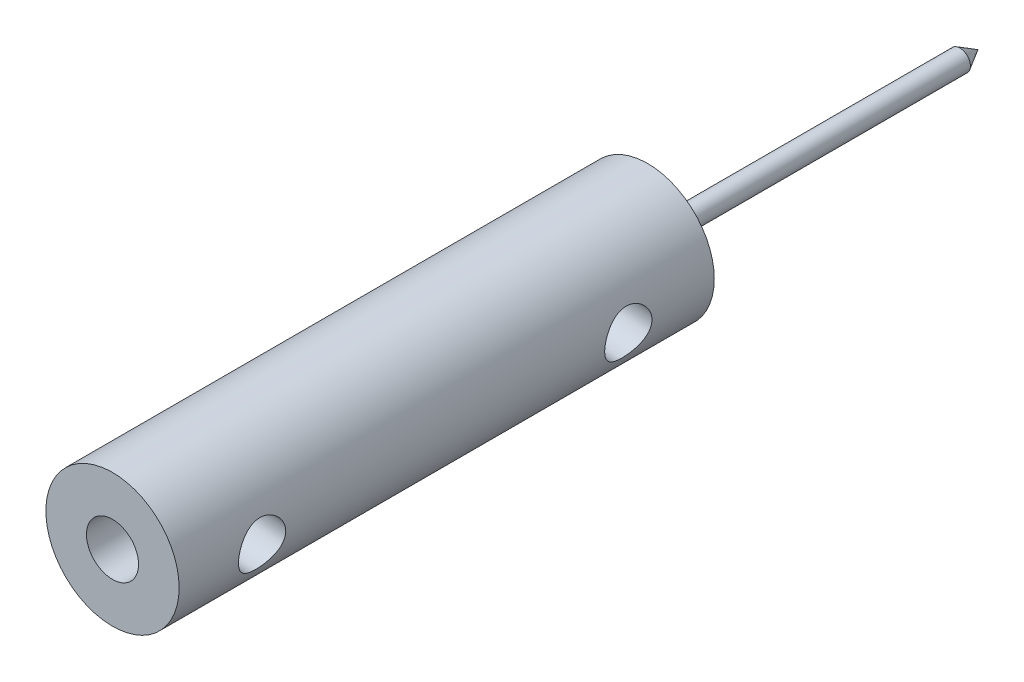
from build123d import *

# Parameters (mm, degrees)
SKETCH3_R                           = 3.2
SKETCH3_R_2                         = 0.5
BOSS_EXTRUDE2_DEPTH                 = 25.7
CUT_EXTRUDE1_DEPTH                  = 27.095401894
CUT_EXTRUDE1_DEPTH_BACK             = 25.7
SKETCH6_R                           = 1.25
TAP_DRILL_FOR_4_40_TAP1_D           = 2.2606
TAP_DRILL_FOR_4_40_TAP1_ON_FACE_2_D = 2.2606
BOSS_EXTRUDE4_START                 = 5
SKETCH3_4_R                         = 0.5
BOSS_EXTRUDE4_DEPTH                 = 20
BOSS_EXTRUDE5_START                 = -20.7
SKETCH6_2_R                         = 1.25
SKETCH6_2_R_2                       = 0.5
BOSS_EXTRUDE5_DEPTH                 = 5


with BuildPart() as part:
    # Sketch3 → Boss-Extrude2 (new body)
    with BuildSketch(Plane.XY):
        with Locations(Location((0, 0, 0), (0, 0, 180))):
            Circle(SKETCH3_R)
        Circle(SKETCH3_R_2, mode=Mode.SUBTRACT)
    extrude(amount=BOSS_EXTRUDE2_DEPTH)

    # Sketch6 → Cut-Extrude1 (cut, two sides: drawn at the far end of the back side and taken through both)
    with BuildSketch(Plane.XY.offset(25.7).offset(-CUT_EXTRUDE1_DEPTH_BACK)):
        with Locations(Location((0, 0, 0), (0, 0, 180))):
            Circle(SKETCH6_R)
    extrude(amount=CUT_EXTRUDE1_DEPTH + CUT_EXTRUDE1_DEPTH_BACK, mode=Mode.SUBTRACT)

    # Tap Drill for #4-40 Tap1 (through all)
    with Locations(Plane(origin=(3.187528357, -0.282246299, 21.7), x_dir=(0.088201968553, 0.996102611553, 0), z_dir=(0.996102611553, -0.088201968553, 0))):
        with Locations((0, 0)):
            Hole(TAP_DRILL_FOR_4_40_TAP1_D / 2)

    # Tap Drill for #4-40 Tap1 on face 2 (through all)
    with Locations(Plane(origin=(3.187528357, -0.282246299, 4.112360987), x_dir=(0.088201965627, 0.996102611812, 0), z_dir=(0.996102611812, -0.088201965627, 0))):
        with Locations((0, 0)):
            Hole(TAP_DRILL_FOR_4_40_TAP1_ON_FACE_2_D / 2)



with BuildPart() as body_2:
    # Sketch3<4> → Boss-Extrude4 (new body)
    with BuildSketch(Plane.XY.offset(BOSS_EXTRUDE4_START)):
        Circle(SKETCH3_4_R)
    extrude(amount=-BOSS_EXTRUDE4_DEPTH)

    # Sketch9 → Revolve1 (revolve)
    with BuildSketch(Plane(origin=(0, 0, 0), x_dir=(1, 0, 0), z_dir=(0, 1, 0)), mode=Mode.PRIVATE) as revolve1_sk:
        Polygon((0, 15), (-0.5, 15), (0, 15.866025404), align=None)
    revolve(revolve1_sk.sketch.rotate(Axis((0, 0, -15), (0, 0, -1)), 180), axis=Axis((0, 0, -15), (0, 0, -1)))


with BuildPart() as part_1:
    add(part.part)

    add(body_2.part)  # Boss-Extrude5 merges body 2
    # Sketch6<2> → Boss-Extrude5 (add)
    with BuildSketch(Plane.XY.offset(25.7).offset(BOSS_EXTRUDE5_START)):
        with Locations(Location((0, 0, 0), (0, 0, 208.982799993))):
            Circle(SKETCH6_2_R)
        Circle(SKETCH6_2_R_2, mode=Mode.SUBTRACT)
    extrude(amount=-BOSS_EXTRUDE5_DEPTH)


solid = part_1.part
